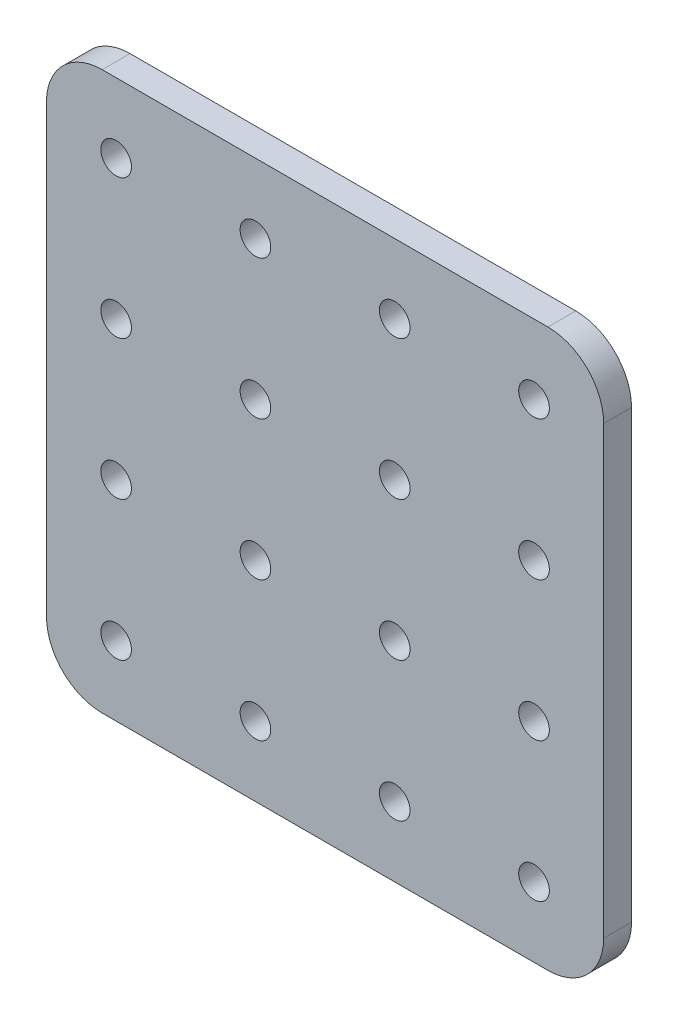
from build123d import *

# Parameters (mm, degrees)
SKETCH1_W           = 50.8
SKETCH1_H           = 50.8
SKETCH1_R           = 1.397
BOSS_EXTRUDE1_DEPTH = 2.54
FILLET1_R           = 5.08


with BuildPart() as part:
    # Sketch1 → Boss-Extrude1 (new body)
    with BuildSketch(Plane.XY):
        with Locations((19.05, -19.05)):
            Rectangle(SKETCH1_W, SKETCH1_H)
        Circle(SKETCH1_R, mode=Mode.SUBTRACT)
        with Locations((12.7, 0)):
            Circle(SKETCH1_R, mode=Mode.SUBTRACT)
        with Locations((25.4, 0)):
            Circle(SKETCH1_R, mode=Mode.SUBTRACT)
        with Locations((38.1, 0)):
            Circle(SKETCH1_R, mode=Mode.SUBTRACT)
        with Locations((12.7, -12.7)):
            Circle(SKETCH1_R, mode=Mode.SUBTRACT)
        with Locations((25.4, -12.7)):
            Circle(SKETCH1_R, mode=Mode.SUBTRACT)
        with Locations((38.1, -12.7)):
            Circle(SKETCH1_R, mode=Mode.SUBTRACT)
        with Locations((12.7, -25.4)):
            Circle(SKETCH1_R, mode=Mode.SUBTRACT)
        with Locations((25.4, -25.4)):
            Circle(SKETCH1_R, mode=Mode.SUBTRACT)
        with Locations((38.1, -25.4)):
            Circle(SKETCH1_R, mode=Mode.SUBTRACT)
        with Locations((12.7, -38.1)):
            Circle(SKETCH1_R, mode=Mode.SUBTRACT)
        with Locations((25.4, -38.1)):
            Circle(SKETCH1_R, mode=Mode.SUBTRACT)
        with Locations((38.1, -38.1)):
            Circle(SKETCH1_R, mode=Mode.SUBTRACT)
        with Locations((0, -12.7)):
            Circle(SKETCH1_R, mode=Mode.SUBTRACT)
        with Locations((0, -25.4)):
            Circle(SKETCH1_R, mode=Mode.SUBTRACT)
        with Locations((0, -38.1)):
            Circle(SKETCH1_R, mode=Mode.SUBTRACT)
    extrude(amount=BOSS_EXTRUDE1_DEPTH)

    # Fillet1
    fillet1_edges = [part.edges().sort_by_distance(p)[0] for p in [
        (-6.35, 6.35, 1.27),
        (44.45, 6.35, 1.27),
        (44.45, -44.45, 1.27),
        (-6.35, -44.45, 1.27),
    ]]
    fillet(fillet1_edges, radius=FILLET1_R)


solid = part.part
